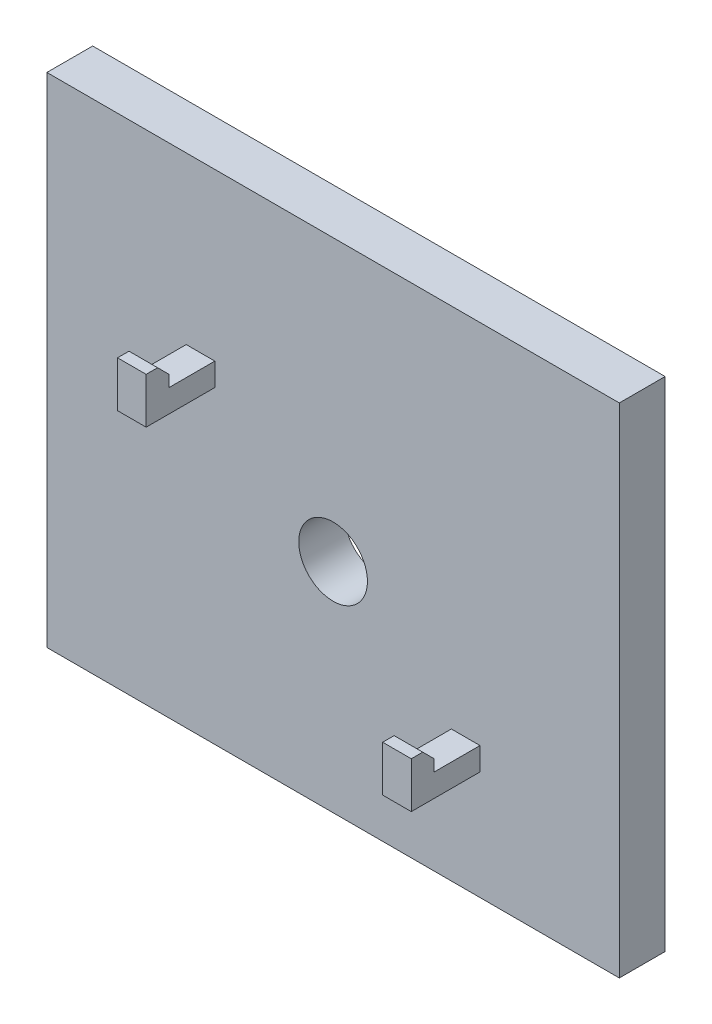
from build123d import *

# Parameters (mm, degrees)
CROQUIS1_W              = 50
CROQUIS1_H              = 43.5
SALIENTE_EXTRUIR1_DEPTH = 4
CROQUIS2_R              = 3
CORTAR_EXTRUIR1_DEPTH   = 4
CROQUIS3_W              = 2.5
CROQUIS3_H              = 2
SALIENTE_EXTRUIR2_DEPTH = 6
CROQUIS4_W              = 2.5
CROQUIS4_H              = 2
SALIENTE_EXTRUIR3_DEPTH = 2
CROQUIS5_W              = 2.5
CROQUIS5_H              = 2
SALIENTE_EXTRUIR4_DEPTH = 2
CHAFL_N1_SIZE           = 1


with BuildPart() as part:
    # Croquis1 → Saliente-Extruir1 (new body)
    with BuildSketch(Plane.XY):
        Rectangle(CROQUIS1_W, CROQUIS1_H)
    extrude(amount=SALIENTE_EXTRUIR1_DEPTH)

    # Croquis2 → Cortar-Extruir1 (cut)
    with BuildSketch(Plane.XY.offset(4)):
        with Locations((0, -2.75)):
            Circle(CROQUIS2_R)
    extrude(amount=-CORTAR_EXTRUIR1_DEPTH, mode=Mode.SUBTRACT)

    # Croquis3 → Saliente-Extruir2 (add)
    with BuildSketch(Plane.XY.offset(4)):
        with Locations((-11.58, 6.25)):
            Rectangle(CROQUIS3_W, CROQUIS3_H)
        with Locations((11.58, -11.25)):
            Rectangle(CROQUIS3_W, CROQUIS3_H)
    extrude(amount=SALIENTE_EXTRUIR2_DEPTH)

    # Croquis4 → Saliente-Extruir3 (add)
    with BuildSketch(Plane(origin=(0, 7.25, 0), x_dir=(1, 0, 0), z_dir=(0, 1, 0))):
        with Locations((-11.58, -9)):
            Rectangle(CROQUIS4_W, CROQUIS4_H)
    extrude(amount=SALIENTE_EXTRUIR3_DEPTH)

    # Croquis5 → Saliente-Extruir4 (add)
    with BuildSketch(Plane(origin=(0, -10.25, 0), x_dir=(1, 0, 0), z_dir=(0, 1, 0))):
        with Locations((11.58, -9)):
            Rectangle(CROQUIS5_W, CROQUIS5_H)
    extrude(amount=SALIENTE_EXTRUIR4_DEPTH)

    # Chaflán1
    chafl_n1_edges = [part.edges().sort_by_distance(p)[0] for p in [
        (-11.58, 9.25, 8),
        (11.58, -8.25, 8),
    ]]
    chamfer(chafl_n1_edges, length=CHAFL_N1_SIZE)


solid = part.part
